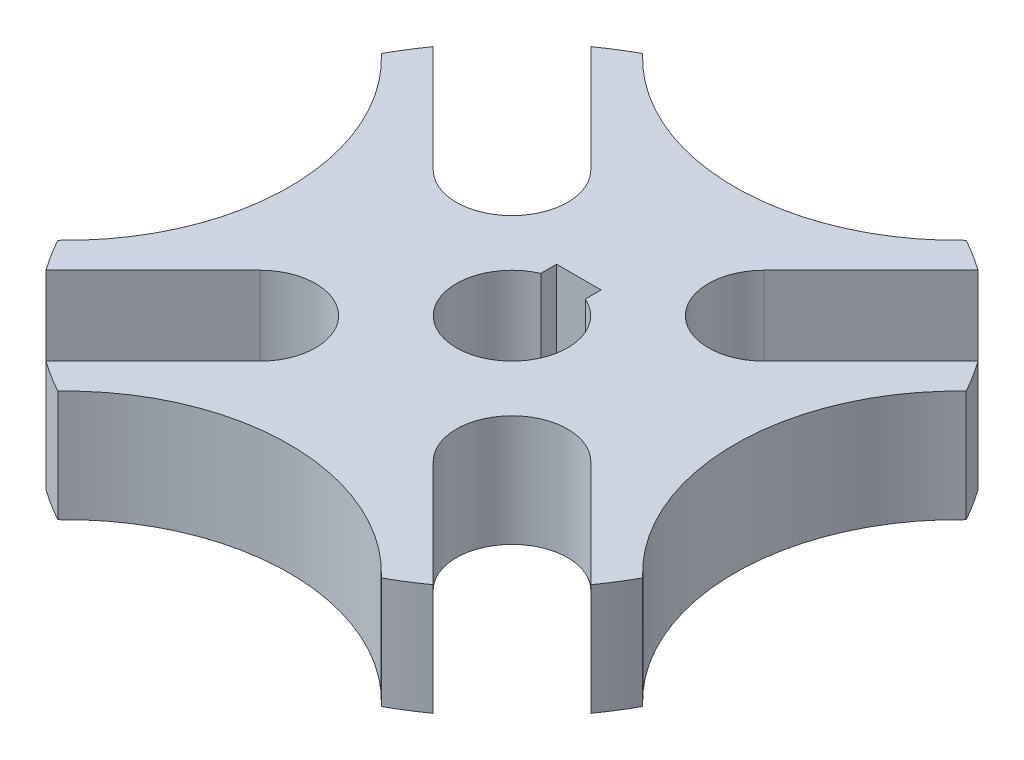
from build123d import *

# Parameters (mm, degrees)
SKETCH_1_R          = 15
SKETCH_1_R_2        = 2.5
EXTRUDE_1_DEPTH     = 5
SKETCH_2_W          = 2
SKETCH_2_H          = 1
CUT_EXTRUDE_1_DEPTH = 10
SKETCH_3_R          = 10
CUT_EXTRUDE_2_DEPTH = 10
CUT_EXTRUDE_3_DEPTH = 10


with BuildPart() as part:
    # 草图1 → 凸台-拉伸1 (new body)
    with BuildSketch(Plane(origin=(0, 0, 0), x_dir=(1, 0, 0), z_dir=(0, 1, 0))):
        with Locations(Location((0, 0, 0), (0, 0, 270))):
            Circle(SKETCH_1_R)
        with Locations(Location((0, 0, 0), (0, 0, 270))):
            Circle(SKETCH_1_R_2, mode=Mode.SUBTRACT)
    extrude(amount=EXTRUDE_1_DEPTH)

    # 草图2 → 切除-拉伸1 (cut)
    with BuildSketch(Plane(origin=(0, 5, 0), x_dir=(1, 0, 0), z_dir=(0, 1, 0))):
        with Locations((0, 2.5)):
            Rectangle(SKETCH_2_W, SKETCH_2_H)
    extrude(amount=-CUT_EXTRUDE_1_DEPTH, mode=Mode.SUBTRACT)

    # 草图3 → 切除-拉伸2 (cut)
    with BuildSketch(Plane(origin=(0, 5, 0), x_dir=(1, 0, 0), z_dir=(0, 1, 0))):
        with Locations((0, 20)):
            Circle(SKETCH_3_R)
        with Locations((20, 0)):
            Circle(SKETCH_3_R)
        with Locations((0, -20)):
            Circle(SKETCH_3_R)
        with Locations((-20, 0)):
            Circle(SKETCH_3_R)
    extrude(amount=-CUT_EXTRUDE_2_DEPTH, mode=Mode.SUBTRACT)

    # 草图4 → 切除-拉伸3 (cut)
    with BuildSketch(Plane(origin=(0, 5, 0), x_dir=(1, 0, 0), z_dir=(0, 1, 0))):
        with BuildLine():
            Line((-12.639931989, 9.104398083), (-7.424621202, 3.889087297))
            ThreePointArc((-7.424621202, 3.889087297), (-3.889087297, 3.889087297), (-3.889087297, 7.424621202))
            Line((-3.889087297, 7.424621202), (-9.104398083, 12.639931989))
            Line((-9.104398083, 12.639931989), (-12.639931989, 9.104398083))
        make_face()
        with BuildLine():
            Line((12.639931989, 9.104398083), (7.424621202, 3.889087297))
            ThreePointArc((7.424621202, 3.889087297), (3.889087297, 3.889087297), (3.889087297, 7.424621202))
            Line((3.889087297, 7.424621202), (9.104398083, 12.639931989))
            Line((9.104398083, 12.639931989), (12.639931989, 9.104398083))
        make_face()
        with BuildLine():
            Line((9.104398083, -12.639931989), (3.889087297, -7.424621202))
            ThreePointArc((3.889087297, -7.424621202), (3.889087297, -3.889087297), (7.424621202, -3.889087297))
            Line((7.424621202, -3.889087297), (12.639931989, -9.104398083))
            Line((12.639931989, -9.104398083), (9.104398083, -12.639931989))
        make_face()
        with BuildLine():
            Line((-12.639931989, -9.104398083), (-7.424621202, -3.889087297))
            ThreePointArc((-7.424621202, -3.889087297), (-3.889087297, -3.889087297), (-3.889087297, -7.424621202))
            Line((-3.889087297, -7.424621202), (-9.104398083, -12.639931989))
            Line((-9.104398083, -12.639931989), (-12.639931989, -9.104398083))
        make_face()
    extrude(amount=-CUT_EXTRUDE_3_DEPTH, mode=Mode.SUBTRACT)


solid = part.part
